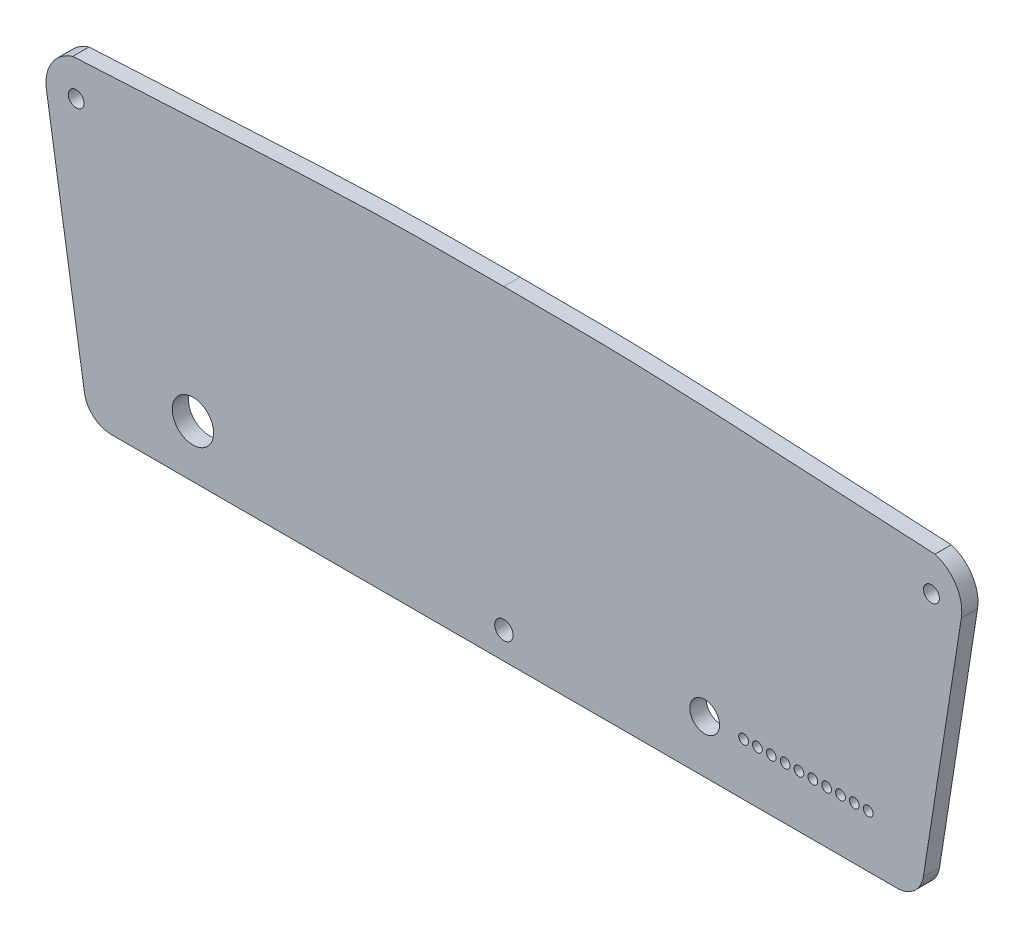
from build123d import *

# Parameters (mm, degrees)
SALIENTE_EXTRUIR3_DEPTH        = 3
TALADRO_DE_MARGEN_PARA_31_D    = 2.921
TALADRO_DE_MARGEN_PARA_M31_D   = 3.4
TALADRO_DE_MARGEN_PARA_M51_D   = 5.5
TALADRO_DE_MARGEN_PARA_M1_61_D = 1.8
CROQUIS20_R                    = 3.825
CORTAR_EXTRUIR1_DEPTH          = 10


with BuildPart() as part:
    # Croquis1 → Saliente-Extruir3 (new body)
    with BuildSketch(Plane.XY):
        with BuildLine():
            Line((72.6209879, -42.713924632), (-72.6209879, -42.713924632))
            ThreePointArc((-72.6209879, -42.713924632), (-75.872299777, -41.512473181), (-77.561094305, -38.485513064))
            Line((-77.561094305, -38.485513064), (-84.58908741, 6.511317248))
            ThreePointArc((-84.58908741, 6.511317248), (-83.604933224, 11.307915351), (-79.718228228, 14.286075368))
            add(Edge.make_bspline(
                [(-79.718228228, 14.286075368), (-25, 17.286075368), (0, 17.286075368)],
                knots=[0, 0, 0, 1, 1, 1], degree=2, weights=[1, 3, 1]))
            add(Edge.make_bspline(
                [(79.718228228, 14.286075368), (25, 17.286075368), (0, 17.286075368)],
                knots=[0, 0, 0, 1, 1, 1], degree=2, weights=[1, 3, 1]))
            ThreePointArc((79.718228228, 14.286075368), (83.604933224, 11.307915351), (84.58908741, 6.511317248))
            Line((84.58908741, 6.511317248), (77.561094305, -38.485513064))
            ThreePointArc((77.561094305, -38.485513064), (75.872299777, -41.512473181), (72.6209879, -42.713924632))
        make_face()
    extrude(amount=SALIENTE_EXTRUIR3_DEPTH)

    # Taladro de margen para #31 (through all)
    with Locations(Plane(origin=(-79.096485455, 7.800604527, 0), x_dir=(-1, 0, 0), z_dir=(0, 0, -1))):
        with Locations((0, 0), (-158.162710078, -0.193745428)):
            Hole(TALADRO_DE_MARGEN_PARA_31_D / 2)

    # Taladro de margen para M31 (through all)
    with Locations(Plane(origin=(0, -37.713924632, 0), x_dir=(-1, 0, 0), z_dir=(0, 0, -1))):
        with Locations((0, 0)):
            Hole(TALADRO_DE_MARGEN_PARA_M31_D / 2)

    # Taladro de margen para M51 (through all)
    with Locations(Plane(origin=(37.125664754, -33.014735769, 0), x_dir=(-1, 0, 0), z_dir=(0, 0, -1))):
        with Locations((0, 0)):
            Hole(TALADRO_DE_MARGEN_PARA_M51_D / 2)

    # Taladro de margen para M1.61 (through all)
    with Locations(Plane(origin=(44.322164269, -33.014735769, 0), x_dir=(-1, 0, 0), z_dir=(0, 0, -1))):
        with Locations((0, 0), (-2.56, 0), (-5.12, 0), (-7.68, 0), (-10.24, 0), (-12.8, 0), (-15.36, 0), (-17.92, 0), (-20.48, 0), (-23.04, 0)):
            Hole(TALADRO_DE_MARGEN_PARA_M1_61_D / 2)

    # Croquis20 → Cortar-Extruir1 (cut)
    with BuildSketch(Plane.XY.offset(3)):
        with Locations((-57.496824338, -33.014735769)):
            Circle(CROQUIS20_R)
    extrude(amount=-CORTAR_EXTRUIR1_DEPTH, mode=Mode.SUBTRACT)


solid = part.part
